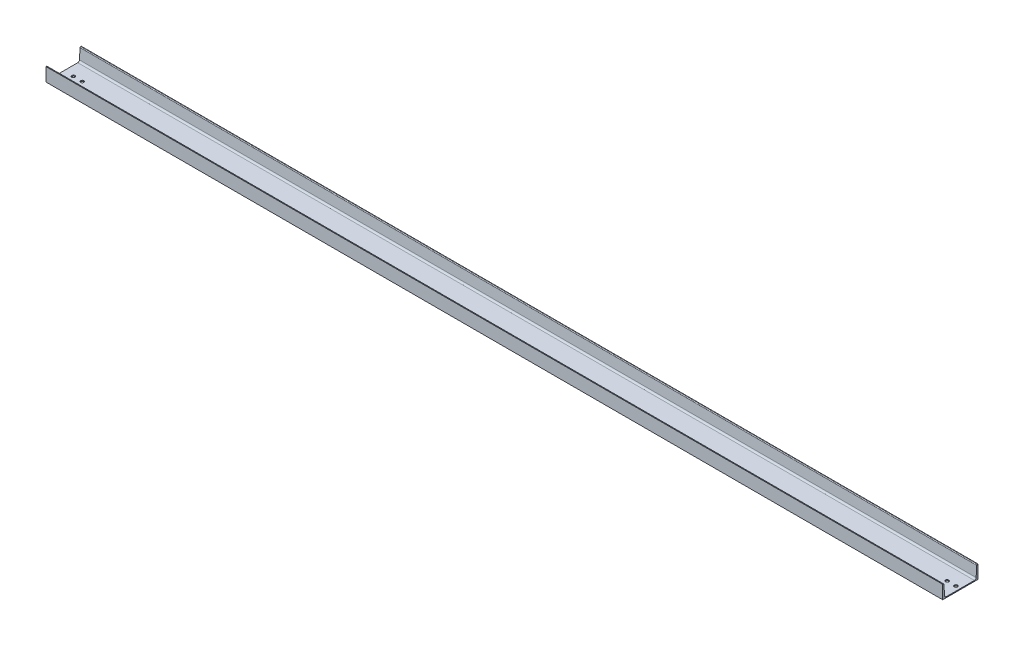
from build123d import *

# Parameters (mm, degrees)
MEMBER_8240_89_20_1_DEPTH = 5080
SKETCH_3_R                = 9
CUT_EXTRUDE_1_DEPTH       = 10


with BuildPart() as part:
    # Sketch1 → Member 8240-89 _ _ 20_1 (new body)
    with BuildSketch(Plane.YZ):
        with BuildLine():
            Line((-15.5, -79.928915362), (-15.5, 79.928915362))
            ThreePointArc((-15.5, 79.928915362), (-12.915753004, 86.442160359), (-6.568976762, 89.411861394))
            Line((-6.568976762, 89.411861394), (51.539569163, 92.89837415))
            ThreePointArc((51.539569163, 92.89837415), (54.211896002, 94.148774586), (55.3, 96.891193532))
            Line((55.3, 96.891193532), (55.3, 100))
            Line((55.3, 100), (-20.7, 100))
            Line((-20.7, 100), (-20.7, -100))
            Line((-20.7, -100), (55.3, -100))
            Line((55.3, -100), (55.3, -96.891193532))
            ThreePointArc((55.3, -96.891193532), (54.211896002, -94.148774586), (51.539569163, -92.89837415))
            Line((51.539569163, -92.89837415), (-6.568976762, -89.411861394))
            ThreePointArc((-6.568976762, -89.411861394), (-12.915753004, -86.442160359), (-15.5, -79.928915362))
        make_face()
    extrude(amount=MEMBER_8240_89_20_1_DEPTH)

    # Эскиз3 → Вырез-Вытянуть1 (cut)
    with BuildSketch(Plane.XZ.offset(20.7)):
        with Locations(Location((55, 0, 0), (0, 0, 270))):
            Circle(SKETCH_3_R)
        with Locations(Location((105, 0, 0), (0, 0, 270))):
            Circle(SKETCH_3_R)
        with Locations(Location((5005, 0, 0), (0, 0, 270))):
            Circle(SKETCH_3_R)
        with Locations(Location((5055, 0, 0), (0, 0, 270))):
            Circle(SKETCH_3_R)
    extrude(amount=-CUT_EXTRUDE_1_DEPTH, mode=Mode.SUBTRACT)


solid = part.part
